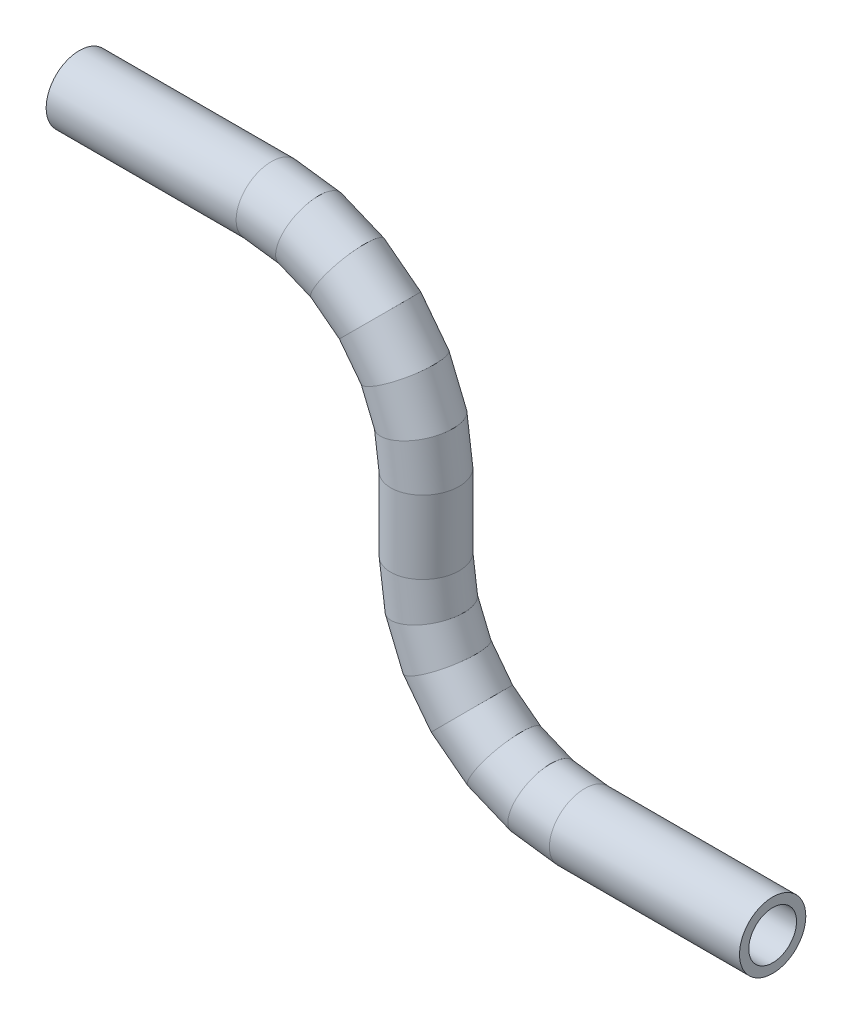
from build123d import *

# Parameters (mm, degrees)
PROFILE_R   = 3.175
PROFILE_R_2 = 2.286


with BuildPart() as part:
    # Tube: sweep along a curve in space
    with BuildLine() as tube_path:
        Line((-2754.892778381, 33, 0), (-2773.092778381, 33, 0))
        Line((-2773.092778381, 33, 0), (-2776.975064057, 33.511112606, 0))
        Line((-2776.975064057, 33.511112606, 0), (-2780.592778381, 35.009618943, 0))
        Line((-2780.592778381, 35.009618943, 0), (-2783.699380099, 37.393398282, 0))
        Line((-2783.699380099, 37.393398282, 0), (-2786.083159438, 40.5, 0))
        Line((-2786.083159438, 40.5, 0), (-2787.581665775, 44.117714323, 0))
        Line((-2787.581665775, 44.117714323, 0), (-2788.092778381, 48, 0))
        Line((-2788.092778381, 48, 0), (-2788.092778381, 55, 0))
        Line((-2788.092778381, 55, 0), (-2788.603890986, 58.882285677, 0))
        Line((-2788.603890986, 58.882285677, 0), (-2790.102397324, 62.5, 0))
        Line((-2790.102397324, 62.5, 0), (-2792.486176663, 65.606601718, 0))
        Line((-2792.486176663, 65.606601718, 0), (-2795.592778381, 67.990381057, 0))
        Line((-2795.592778381, 67.990381057, 0), (-2799.210492704, 69.488887394, 0))
        Line((-2799.210492704, 69.488887394, 0), (-2803.092778381, 70, 0))
        Line((-2803.092778381, 70, 0), (-2821.292778381, 70, 0))
    # Profile → Tube (sweep)
    with BuildSketch(Plane(origin=(-2754.892778381, 0, 0), x_dir=(0, 0, -1), z_dir=(1, 0, 0))):
        with Locations((0, 33)):
            Circle(PROFILE_R)
        with Locations((0, 33)):
            Circle(PROFILE_R_2, mode=Mode.SUBTRACT)
    sweep(path=tube_path.line, transition=Transition.RIGHT)


solid = part.part
